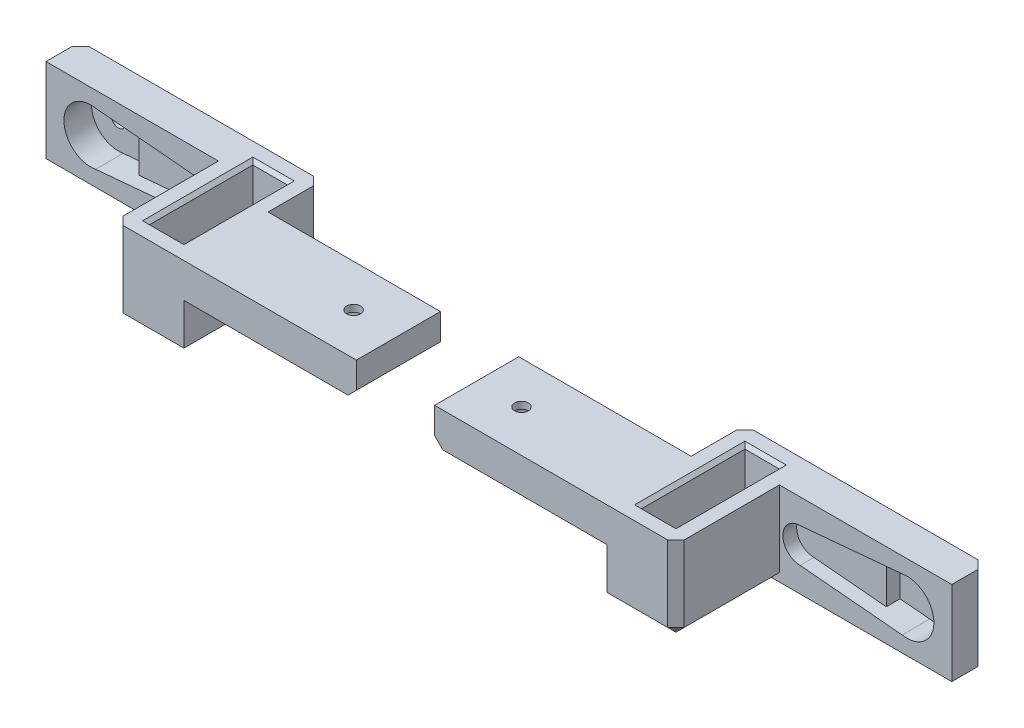
from build123d import *

# Parameters (mm, degrees)
SKETCH1_W               = 35
SKETCH1_H               = 12.2
BOSS_EXTRUDE1_DEPTH     = 5
SKETCH2_R               = 1
CUT_EXTRUDE1_DEPTH      = 38.775970389
SKETCH3_W               = 10
SKETCH3_H               = 12.2
BOSS_EXTRUDE2_DEPTH     = 15
SKETCH4_W               = 12.2
SKETCH4_H               = 5
BOSS_EXTRUDE3_DEPTH     = 25
CUT_EXTRUDE2_DEPTH      = 42.419255471
CUT_EXTRUDE2_DEPTH_BACK = 42.419255471
SKETCH5_R               = 1
CUT_EXTRUDE3_DEPTH      = 0.5
CHAMFER1_SIZE           = 1.2
SKETCH8_R               = 3.9
CUT_EXTRUDE4_DEPTH      = 4
CUT_EXTRUDE5_DEPTH      = 2
CUT_EXTRUDE6_DEPTH      = 4
SKETCH20_R              = 3.9
CUT_EXTRUDE11_DEPTH     = 4
CUT_EXTRUDE12_DEPTH     = 2
CUT_EXTRUDE13_DEPTH     = 4
SKETCH23_W              = 5
SKETCH23_H              = 15
CUT_EXTRUDE14_DEPTH     = 43.574108608
CHAMFER2_SIZE           = 0.5


with BuildPart() as part:
    # Sketch1 → Boss-Extrude1 (new body)
    with BuildSketch(Plane.XY):
        with Locations((-18.048765432, 5.660493827)):
            Rectangle(SKETCH1_W, SKETCH1_H)
    extrude(amount=BOSS_EXTRUDE1_DEPTH)

    # Sketch2 → Cut-Extrude1 (cut, through all)
    with BuildSketch(Plane.XY.offset(5)):
        with Locations((-29.048765432, 5.660493827)):
            Circle(SKETCH2_R)
    extrude(amount=-CUT_EXTRUDE1_DEPTH, mode=Mode.SUBTRACT)

    # Sketch3 → Boss-Extrude2 (add)
    with BuildSketch(Plane.XY.offset(5)):
        with Locations((-5.548765432, 5.660493827)):
            Rectangle(SKETCH3_W, SKETCH3_H)
    extrude(amount=BOSS_EXTRUDE2_DEPTH)

    # Sketch4 → Boss-Extrude3 (add)
    with BuildSketch(Plane(origin=(-0.548765432, 0, 0), x_dir=(0, 0, -1), z_dir=(1, 0, 0))):
        with Locations((-13.9, 9.260493827)):
            Rectangle(SKETCH4_W, SKETCH4_H)
    extrude(amount=BOSS_EXTRUDE3_DEPTH)

    # Sketch5 → Cut-Extrude2 (cut, two sides: drawn at the far end of the back side and taken through both)
    with BuildSketch(Plane.XZ.offset(-6.760493827).offset(-CUT_EXTRUDE2_DEPTH_BACK)):
        with Locations(Location((17.951234568, 13.9, 0), (0, 0, 270))):
            Circle(SKETCH5_R)
    extrude(amount=CUT_EXTRUDE2_DEPTH + CUT_EXTRUDE2_DEPTH_BACK, mode=Mode.SUBTRACT)

    # Sketch7 → Cut-Extrude3 (cut)
    with BuildSketch(Plane(origin=(0, 0, 0), x_dir=(-1, 0, 0), z_dir=(0, 0, -1))):
        Polygon((23.048765432, 5.660493827), (19.298765432, 7.825557337), (19.298765432, 3.495430318), align=None)
    extrude(amount=-CUT_EXTRUDE3_DEPTH, mode=Mode.SUBTRACT)

    # Chamfer1
    chamfer1_edges = [part.edges().sort_by_distance(p)[0] for p in [
        (-10.548765432, -0.439506173, 12.5),
        (-10.548765432, 5.660493827, 20),
        (-5.548765432, -0.439506173, 20),
        (24.451234568, 6.760493827, 13.9),
        (-0.548765432, 5.660493827, 0),
        (-18.048765432, -0.439506173, 0),
        (-35.548765432, 5.660493827, 0),
        (-0.548765432, -0.439506173, 10),
    ]]
    chamfer(chamfer1_edges, length=CHAMFER1_SIZE)

    # Sketch8 → Cut-Extrude4 (cut)
    with BuildSketch(Plane.XY.offset(5)):
        with Locations((-29.048765432, 5.660493827)):
            Circle(SKETCH8_R)
    extrude(amount=-CUT_EXTRUDE4_DEPTH, mode=Mode.SUBTRACT)

    # Sketch10 → Cut-Extrude5 (cut)
    with BuildSketch(Plane.XY.offset(5)):
        with BuildLine():
            Line((-29.048765432, 9.560493827), (-13.548765432, 8.160493827))
            ThreePointArc((-13.548765432, 8.160493827), (-11.048765432, 5.660493827), (-13.548765432, 3.160493827))
            Line((-13.548765432, 3.160493827), (-29.048765432, 1.760493827))
            Line((-29.048765432, 1.760493827), (-29.048765432, 9.560493827))
        make_face()
    extrude(amount=-CUT_EXTRUDE5_DEPTH, mode=Mode.SUBTRACT)

    # Sketch12 → Cut-Extrude6 (cut)
    with BuildSketch(Plane.XY.offset(5)):
        Polygon((-24.048765432, 5.660493827), (-24.048765432, 9.108880924), (-29.048765432, 9.560493827), (-29.048765432, 1.760493827), (-24.048765432, 2.21210673), align=None)
    extrude(amount=-CUT_EXTRUDE6_DEPTH, mode=Mode.SUBTRACT)

    # Sketch20 → Cut-Extrude11 (cut)
    with BuildSketch(Plane.XZ.offset(-6.760493827)):
        with Locations(Location((17.951234568, 13.9, 0), (0, 0, 270))):
            Circle(SKETCH20_R)
    extrude(amount=-CUT_EXTRUDE11_DEPTH, mode=Mode.SUBTRACT)

    # Sketch21 → Cut-Extrude12 (cut)
    with BuildSketch(Plane.XZ.offset(-6.760493827)):
        with BuildLine():
            Line((17.951234568, 17.8), (2.21295028, 16.4))
            ThreePointArc((2.21295028, 16.4), (-0.28704972, 13.9), (2.21295028, 11.4))
            Line((2.21295028, 11.4), (17.951234568, 10))
            Line((17.951234568, 10), (17.951234568, 17.8))
        make_face()
    extrude(amount=-CUT_EXTRUDE12_DEPTH, mode=Mode.SUBTRACT)

    # Sketch22 → Cut-Extrude13 (cut)
    with BuildSketch(Plane.XZ.offset(-6.760493827)):
        Polygon((17.951234568, 17.8), (17.951234568, 10), (12.951234568, 10.444775293), (12.951234568, 17.355224707), align=None)
    extrude(amount=-CUT_EXTRUDE13_DEPTH, mode=Mode.SUBTRACT)

    # Sketch23 → Cut-Extrude14 (cut, through all)
    with BuildSketch(Plane(origin=(0, 11.760493827, 0), x_dir=(1, 0, 0), z_dir=(0, 1, 0))):
        with Locations((-5.548765432, -10)):
            Rectangle(SKETCH23_W, SKETCH23_H)
    extrude(amount=-CUT_EXTRUDE14_DEPTH, mode=Mode.SUBTRACT)

    # Chamfer2
    chamfer2_edges = [part.edges().sort_by_distance(p)[0] for p in [
        (-8.048765432, -0.439506173, 10),
        (-5.548765432, -0.439506173, 2.5),
        (-3.048765432, -0.439506173, 10),
        (-5.548765432, -0.439506173, 17.5),
        (-8.048765432, 11.760493827, 10),
        (-5.548765432, 11.760493827, 17.5),
        (-3.048765432, 11.760493827, 10),
        (-5.548765432, 11.760493827, 2.5),
    ]]
    chamfer(chamfer2_edges, length=CHAMFER2_SIZE)


with BuildPart() as body_2:
    # Mirror3: mirrored copy
    add(part.part.mirror(Plane(origin=(30.129011824, 0, 0), x_dir=(0, 0, 1), z_dir=(1, 0, 0))))


solid = Compound([part.part, body_2.part])
